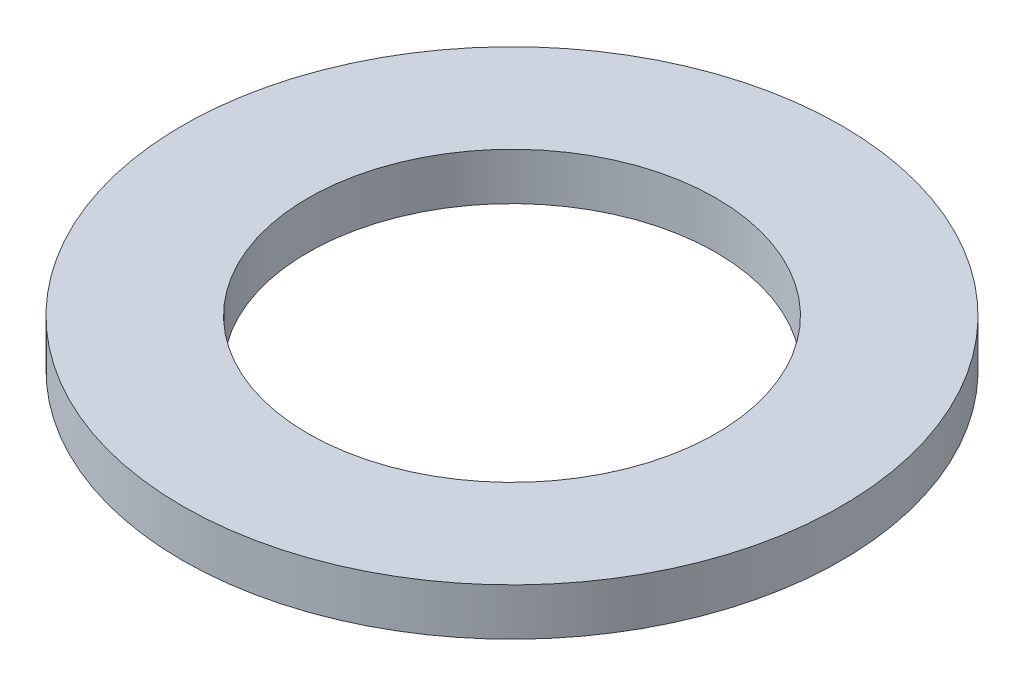
from build123d import *

# Parameters (mm, degrees)
SKETCH2_R           = 10.5
SKETCH2_R_2         = 6.5
BOSS_EXTRUDE1_DEPTH = 1.5


with BuildPart() as part:
    # Sketch2 → Boss-Extrude1 (new body)
    with BuildSketch(Plane(origin=(0, 0, 0), x_dir=(1, 0, 0), z_dir=(0, 1, 0))):
        with Locations(Location((0, 0, 0), (0, 0, 270))):
            Circle(SKETCH2_R)
        with Locations(Location((0, 0, 0), (0, 0, 270))):
            Circle(SKETCH2_R_2, mode=Mode.SUBTRACT)
    extrude(amount=BOSS_EXTRUDE1_DEPTH)


solid = part.part
